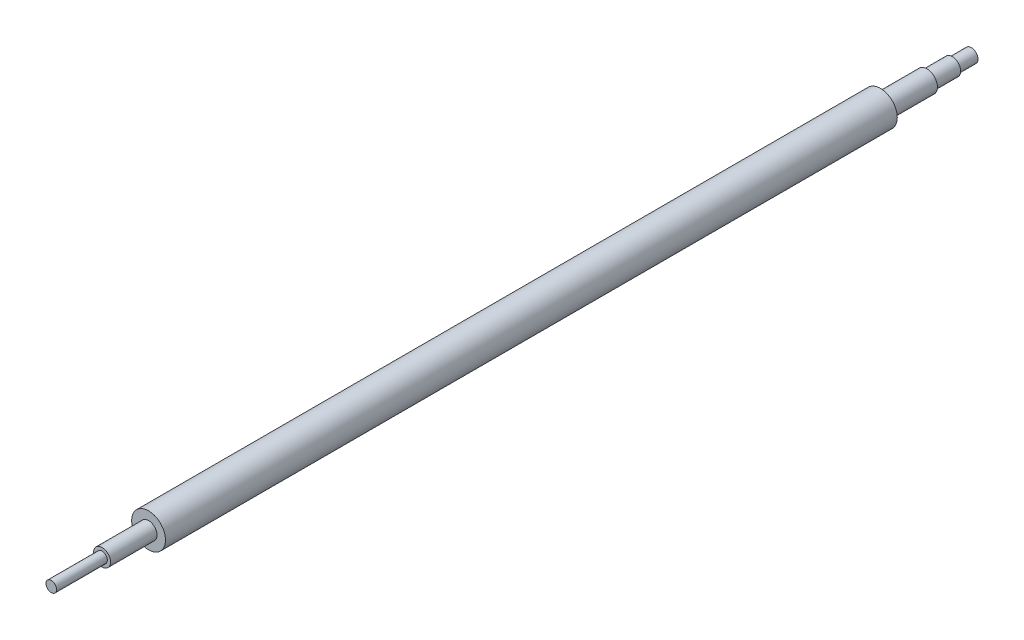
from build123d import *

# Parameters (mm, degrees)
SKETCH_1_R      = 8
EXTRUDE_1_DEPTH = 346
SKETCH_2_R      = 4
EXTRUDE_2_DEPTH = 22
SKETCH_4_R      = 5
EXTRUDE_3_DEPTH = 22
SKETCH_5_R      = 2.5
EXTRUDE_4_DEPTH = 24
SKETCH_9_R      = 4
EXTRUDE_5_DEPTH = 12
SKETCH_10_R     = 3.175
EXTRUDE_6_DEPTH = 9


with BuildPart() as part:
    # 草图1 → 凸台-拉伸1 (new body)
    with BuildSketch(Plane.XY):
        Circle(SKETCH_1_R)
    extrude(amount=EXTRUDE_1_DEPTH)


with BuildPart() as body_2:
    # 草图2 → 凸台-拉伸2 (new body)
    with BuildSketch(Plane.XY.offset(346)):
        Circle(SKETCH_2_R)
    extrude(amount=EXTRUDE_2_DEPTH)


with BuildPart() as body_3:
    # 草图4 → 凸台-拉伸3 (new body)
    with BuildSketch(Plane(origin=(0, 0, 0), x_dir=(-1, 0, 0), z_dir=(0, 0, -1))):
        Circle(SKETCH_4_R)
    extrude(amount=EXTRUDE_3_DEPTH)

    # 草图9 → 凸台-拉伸5 (add)
    with BuildSketch(Plane(origin=(0, 0, -22), x_dir=(-1, 0, 0), z_dir=(0, 0, -1))):
        Circle(SKETCH_9_R)
    extrude(amount=EXTRUDE_5_DEPTH)

    # 草图10 → 凸台-拉伸6 (add)
    with BuildSketch(Plane(origin=(0, 0, -34), x_dir=(-1, 0, 0), z_dir=(0, 0, -1))):
        Circle(SKETCH_10_R)
    extrude(amount=EXTRUDE_6_DEPTH)


with BuildPart() as body_4:
    # 草图5 → 凸台-拉伸4 (new body)
    with BuildSketch(Plane.XY.offset(368)):
        Circle(SKETCH_5_R)
    extrude(amount=EXTRUDE_4_DEPTH)


solid = Compound([part.part, body_2.part, body_3.part, body_4.part])
